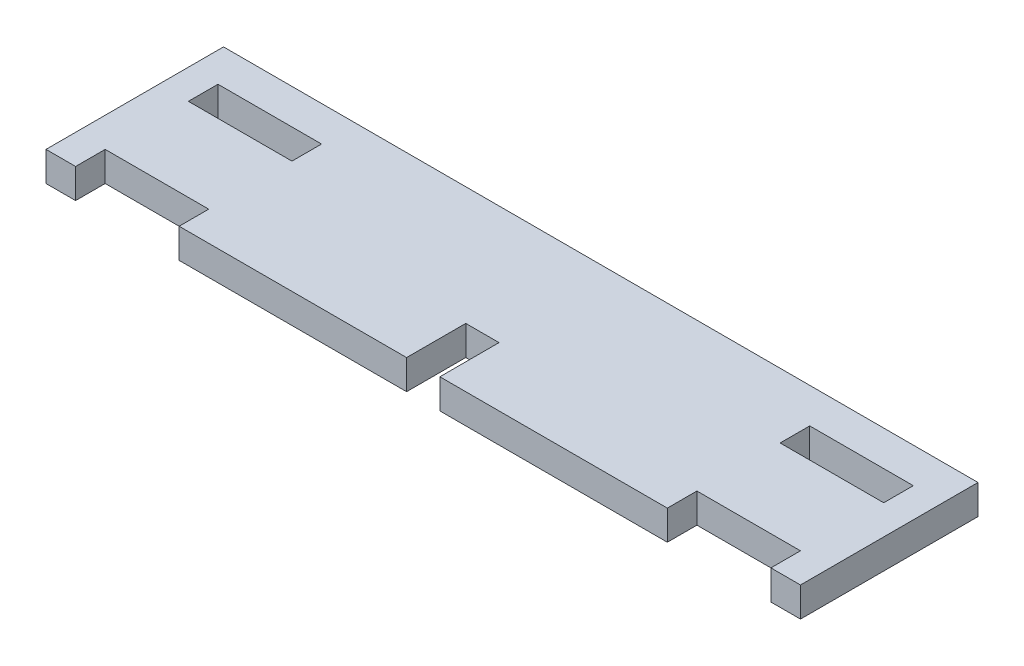
from build123d import *

# Parameters (mm, degrees)
SKETCH1_W           = 14
SKETCH1_H           = 4
BOSS_EXTRUDE1_DEPTH = 4


with BuildPart() as part:
    # Sketch1 → Boss-Extrude1 (new body)
    with BuildSketch(Plane(origin=(0, 0, 0), x_dir=(1, 0, 0), z_dir=(0, 1, 0))):
        Polygon((51, 12), (-51, 12), (-51, -12), (-47, -12), (-47, -8), (-33, -8), (-33, -12), (-2.25, -12), (-2.25, -4), (2.25, -4), (2.25, -12), (33, -12), (33, -8), (47, -8), (47, -12), (51, -12), align=None)
        with Locations((-40, 5.25)):
            Rectangle(SKETCH1_W, SKETCH1_H, mode=Mode.SUBTRACT)
        with Locations((40, 5.25)):
            Rectangle(SKETCH1_W, SKETCH1_H, mode=Mode.SUBTRACT)
    extrude(amount=BOSS_EXTRUDE1_DEPTH)


solid = part.part
